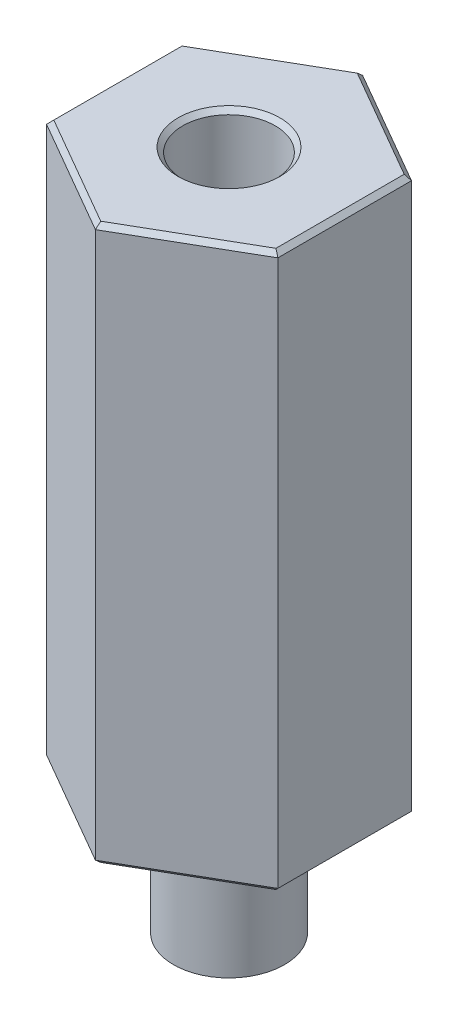
from build123d import *

# Parameters (mm, degrees)
BOSS_EXTRUDE1_DEPTH      = 12
SKETCH2_R                = 1
CUT_EXTRUDE1_DEPTH       = 13.592987467
CHAMFER1_SIZE            = 0.1
BOSS_EXTRUDE2_DEPTH      = 2.7
BOSS_EXTRUDE2_DEPTH_BACK = 2.7
SKETCH3_R                = 1.2


with BuildPart() as part:
    # Sketch1 → Boss-Extrude1 (new body)
    with BuildSketch(Plane(origin=(0, 0, 0), x_dir=(1, 0, 0), z_dir=(0, 1, 0))):
        Polygon((0, 2.886751346), (-2.5, 1.443375673), (-2.5, -1.443375673), (0, -2.886751346), (2.5, -1.443375673), (2.5, 1.443375673), align=None)
    extrude(amount=BOSS_EXTRUDE1_DEPTH)

    # Sketch2 → Cut-Extrude1 (cut, through all)
    with BuildSketch(Plane(origin=(0, 12, 0), x_dir=(1, 0, 0), z_dir=(0, 1, 0))):
        with Locations(Location((0, 0, 0), (0, 0, 270))):
            Circle(SKETCH2_R)
    extrude(amount=-CUT_EXTRUDE1_DEPTH, mode=Mode.SUBTRACT)

    # Chamfer1
    chamfer1_edges = [part.edges().sort_by_distance(p)[0] for p in [
        (-2.5, 12, 0),
        (-1.25, 12, 2.165063509),
        (1.25, 12, 2.165063509),
        (2.5, 12, 0),
        (0, 12, -1),
        (1.25, 12, -2.165063509),
        (2.5, 0, 0),
        (1.25, 0, 2.165063509),
        (-1.25, 0, 2.165063509),
        (-1.25, 12, -2.165063509),
        (-2.5, 0, 0),
        (-1.25, 0, -2.165063509),
        (1.25, 0, -2.165063509),
    ]]
    chamfer(chamfer1_edges, length=CHAMFER1_SIZE)

    # Sketch3 → Boss-Extrude2 (add, two sides: drawn at the far end of the back side and taken through both)
    with BuildSketch(Plane.XZ.offset(-BOSS_EXTRUDE2_DEPTH_BACK)):
        with Locations(Location((0, 0, 0), (0, 0, 270))):
            Circle(SKETCH3_R)
    extrude(amount=BOSS_EXTRUDE2_DEPTH + BOSS_EXTRUDE2_DEPTH_BACK)


solid = part.part
